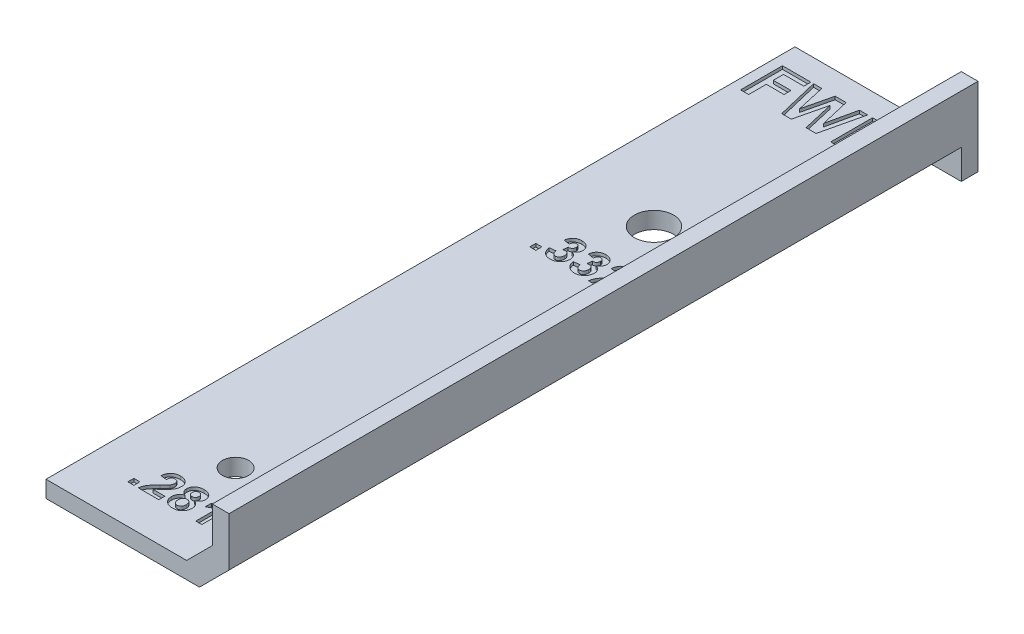
from build123d import *

# Parameters (mm, degrees)
BOSS_EXTRUDE1_DEPTH         = 88.9
F_1_8_0_1250_DOWEL_HOLE2_D  = 3.175
F_3_16_0_1875_DOWEL_HOLE1_D = 4.7625
BOSS_EXTRUDE2_START         = -88.9
BOSS_EXTRUDE2_DEPTH         = 2.032
SKETCH10_W                  = 0.732692308
SKETCH10_H                  = 0.732692308
CUT_EXTRUDE2_DEPTH          = 0.381


with BuildPart() as part:
    # Sketch1 → Boss-Extrude1 (new body)
    with BuildSketch(Plane.XY):
        Polygon((0, 3.592102448), (-3.592102448, 0), (-22.225, 0), (-22.225, 2.032), (-5.152204897, 2.032), (-2.032, 5.152204897), (-2.032, 9.525), (0, 9.525), align=None)
    extrude(amount=BOSS_EXTRUDE1_DEPTH)

    # 1/8 (0.1250) Dowel Hole2 (through all)
    with Locations(Plane(origin=(0, 2.032, 0), x_dir=(1, 0, 0), z_dir=(0, 1, 0))):
        with Locations((-11.90625, -76.2)):
            Hole(F_1_8_0_1250_DOWEL_HOLE2_D / 2)

    # 3/16 (0.1875) Dowel Hole1 (through all)
    with Locations(Plane(origin=(0, 2.032, 0), x_dir=(1, 0, 0), z_dir=(0, 1, 0))):
        with Locations((-11.90625, -25.4)):
            Hole(F_3_16_0_1875_DOWEL_HOLE1_D / 2)

    # Sketch6 → Boss-Extrude2 (add)
    with BuildSketch(Plane.XY.offset(88.9).offset(BOSS_EXTRUDE2_START)):
        Polygon((-22.225, 0), (0, 0), (0, 9.525), (-2.032, 9.525), (-2.032, 5.152204897), (-5.152204897, 2.032), (-22.225, 2.032), align=None)
    extrude(amount=-BOSS_EXTRUDE2_DEPTH)

    # Sketch10 → Cut-Extrude2 (cut)
    # profile 1 of 11: a face of its own
    with BuildSketch(Plane(origin=(0, 2.032, 0), x_dir=(1, 0, 0), z_dir=(0, 1, 0))):
        Polygon((-20.999270946, -5.79415312), (-20.999270946, -0.71415312), (-17.547476074, -0.71415312), (-17.547476074, -1.560819787), (-20.022347869, -1.560819787), (-20.022347869, -2.798255684), (-17.8731171, -2.798255684), (-17.8731171, -3.644922351), (-20.022347869, -3.644922351), (-20.022347869, -5.79415312), align=None)
    # profile 2 of 11: a face of its own
    with BuildSketch(Plane(origin=(0, 2.032, 0), x_dir=(1, 0, 0), z_dir=(0, 1, 0))):
        Polygon((-16.005769343, -5.79415312), (-17.221835049, -0.71415312), (-16.220488895, -0.71415312), (-15.430809407, -4.203600235), (-14.595336651, -0.71415312), (-13.262243702, -0.71415312), (-12.434911972, -4.262622671), (-11.647267741, -0.71415312), (-10.643886331, -0.71415312), (-11.837564215, -5.79415312), (-13.047524151, -5.79415312), (-13.93286069, -1.996364658), (-14.841602677, -5.79415312), align=None)
    # profile 3 of 11: a face of its own
    with BuildSketch(Plane(origin=(0, 2.032, 0), x_dir=(1, 0, 0), z_dir=(0, 1, 0))):
        with BuildLine():
            Line((-10.057732484, -0.71415312), (-8.194455241, -0.71415312))
            add(Edge.make_bspline(
                [(-8.194455241, -0.71415312), (-8.143566114, -0.714126738), (-8.044473164, -0.714075368), (-7.90066335, -0.720041386), (-7.766182685, -0.726042416), (-7.641417162, -0.738055166), (-7.525933931, -0.750646657), (-7.419525761, -0.766588433), (-7.32286484, -0.787019564), (-7.261910517, -0.803131954), (-7.232796587, -0.810827799)],
                knots=[0, 0, 0, 0, 1.259756885, 2.453039283, 3.563158368, 4.591894114, 5.55549294, 6.43918076, 7.254497783, 8, 8, 8, 8], degree=3))
            add(Edge.make_bspline(
                [(-7.232796587, -0.810827799), (-7.196387838, -0.822693979), (-7.124226148, -0.846212599), (-7.018434891, -0.887421139), (-6.918203184, -0.938528038), (-6.819812548, -0.992250897), (-6.727655423, -1.055771929), (-6.636854674, -1.12185706), (-6.553303123, -1.19840977), (-6.443736009, -1.305397224), (-6.318711604, -1.454434132), (-6.187729488, -1.6521241), (-6.076866162, -1.869116038), (-6.001119241, -2.063533259), (-5.949971979, -2.22880432), (-5.916537572, -2.361309804), (-5.888137077, -2.500887431), (-5.864820183, -2.647572389), (-5.846703627, -2.801364699), (-5.833215658, -2.962223367), (-5.826645657, -3.130287355), (-5.825158101, -3.244651031), (-5.824399151, -3.302999274)],
                knots=[0, 0, 0, 0, 0.745524535, 1.477620414, 2.207090574, 2.934465325, 3.657932502, 4.384347339, 5.118673636, 5.861150177, 7.365375624, 8.894729774, 10.468936425, 12.099947606, 12.950091786, 13.83580991, 14.759228729, 15.722225242, 16.726454549, 17.773376212, 18.863978586, 20, 20, 20, 20], degree=3))
            add(Edge.make_bspline(
                [(-5.824399151, -3.302999274), (-5.825784583, -3.403842946), (-5.828463981, -3.598872584), (-5.859504973, -3.880299536), (-5.904238964, -4.141694107), (-5.954663452, -4.304763405), (-5.979078638, -4.383720428)],
                knots=[0, 0, 0, 0, 1.103207939, 2.133582005, 3.096293362, 4, 4, 4, 4], degree=3))
            add(Edge.make_bspline(
                [(-5.979078638, -4.383720428), (-5.995200751, -4.429027688), (-6.026915463, -4.518154138), (-6.082413829, -4.646719479), (-6.142380207, -4.769068417), (-6.207311992, -4.885104555), (-6.277537238, -4.994305959), (-6.353318614, -5.096346002), (-6.433481448, -5.192568072), (-6.491554783, -5.251793212), (-6.520456843, -5.281268505)],
                knots=[0, 0, 0, 0, 1.090884612, 2.145940218, 3.175104604, 4.181306866, 5.161203701, 6.118658341, 7.063689906, 8, 8, 8, 8], degree=3))
            add(Edge.make_bspline(
                [(-6.520456843, -5.281268505), (-6.56722736, -5.323329598), (-6.663674831, -5.410065567), (-6.833631794, -5.517404795), (-7.025730953, -5.612252689), (-7.16468374, -5.660974477), (-7.2368671, -5.68628453)],
                knots=[0, 0, 0, 0, 0.908140292, 1.872714733, 2.8949153, 4, 4, 4, 4], degree=3))
            add(Edge.make_bspline(
                [(-7.2368671, -5.68628453), (-7.265924566, -5.695208943), (-7.326231832, -5.713731101), (-7.42185495, -5.733513148), (-7.523935027, -5.754353731), (-7.633649189, -5.766908419), (-7.749858549, -5.780147894), (-7.873489188, -5.787581119), (-8.004112545, -5.792858277), (-8.093703902, -5.793715106), (-8.139503318, -5.79415312)],
                knots=[0, 0, 0, 0, 0.799129865, 1.658552685, 2.566799617, 3.538529252, 4.561352959, 5.643373779, 6.795284424, 8, 8, 8, 8], degree=3))
            Line((-8.139503318, -5.79415312), (-10.057732484, -5.79415312))
            Line((-10.057732484, -5.79415312), (-10.057732484, -0.71415312))
        make_face()
        with BuildLine():
            Line((-9.080809407, -1.560819787), (-9.080809407, -4.947486453))
            Line((-9.080809407, -4.947486453), (-8.276883125, -4.947486453))
            add(Edge.make_bspline(
                [(-8.276883125, -4.947486453), (-8.240587961, -4.947198608), (-8.170705905, -4.946644395), (-8.069584781, -4.945015909), (-7.976655317, -4.940607288), (-7.891430694, -4.936040676), (-7.814132785, -4.928495833), (-7.744425252, -4.921075193), (-7.682696124, -4.910693872), (-7.644570698, -4.902498995), (-7.626618702, -4.898640299)],
                knots=[0, 0, 0, 0, 1.333384787, 2.567275092, 3.714769766, 4.750907381, 5.701951617, 6.567520054, 7.325492842, 8, 8, 8, 8], degree=3))
            add(Edge.make_bspline(
                [(-7.626618702, -4.898640299), (-7.584573094, -4.887420445), (-7.502679341, -4.865567129), (-7.387692231, -4.816849798), (-7.283643711, -4.758077668), (-7.188791287, -4.687406708), (-7.103309618, -4.59809496), (-7.030340564, -4.483872238), (-6.962809628, -4.347645528), (-6.916564428, -4.217242498), (-6.883369711, -4.100769561), (-6.860899611, -4.003010951), (-6.843142099, -3.89724602), (-6.827868322, -3.783892184), (-6.815526747, -3.663095211), (-6.807847236, -3.534418883), (-6.802605921, -3.398020712), (-6.801758232, -3.304361439), (-6.801322228, -3.256188376)],
                knots=[0, 0, 0, 0, 1.038686998, 2.023088296, 2.974059649, 3.888265163, 4.839857954, 5.909819677, 7.113156087, 8.466843969, 9.20827164, 10.006482943, 10.861893492, 11.769681931, 12.739021491, 13.762258324, 14.849031541, 16, 16, 16, 16], degree=3))
            add(Edge.make_bspline(
                [(-6.801322228, -3.256188376), (-6.801754879, -3.208015166), (-6.802593005, -3.114694581), (-6.80782628, -2.979313459), (-6.815462655, -2.852663425), (-6.827892123, -2.734587919), (-6.842929131, -2.624923753), (-6.860894642, -2.523578126), (-6.883229289, -2.431216137), (-6.91645224, -2.321488388), (-6.966816523, -2.198150991), (-7.035352482, -2.063300551), (-7.119516999, -1.948363722), (-7.212510595, -1.848516221), (-7.319733781, -1.766346773), (-7.43842959, -1.697525075), (-7.571182368, -1.644108376), (-7.665613589, -1.621356452), (-7.714134728, -1.60966594)],
                knots=[0, 0, 0, 0, 1.117996097, 2.165769068, 3.143980016, 4.062055362, 4.920439205, 5.712587309, 6.449616741, 7.124491204, 8.371470382, 9.537068822, 10.625202851, 11.666538334, 12.693249444, 13.747832046, 14.842779399, 16, 16, 16, 16], degree=3))
            add(Edge.make_bspline(
                [(-7.714134728, -1.60966594), (-7.735137041, -1.605763417), (-7.781376095, -1.597171553), (-7.858105355, -1.587136207), (-7.948125873, -1.579689122), (-8.051896558, -1.572086303), (-8.168997232, -1.567746853), (-8.299917873, -1.563217932), (-8.444110639, -1.561670861), (-8.544858914, -1.56111163), (-8.59743601, -1.560819787)],
                knots=[0, 0, 0, 0, 0.578738571, 1.274160813, 2.095454135, 3.025967819, 4.093109015, 5.270126069, 6.575371698, 8, 8, 8, 8], degree=3))
            Line((-8.59743601, -1.560819787), (-9.080809407, -1.560819787))
        make_face(mode=Mode.SUBTRACT)
    # profile 4 of 11: a face of its own
    with BuildSketch(Plane(origin=(0, 2.032, 0), x_dir=(1, 0, 0), z_dir=(0, 1, 0))):
        with Locations((-16.923411588, -34.73131192)):
            Rectangle(SKETCH10_W, SKETCH10_H)
    # profile 5 of 11: a face of its own
    with BuildSketch(Plane(origin=(0, 2.032, 0), x_dir=(1, 0, 0), z_dir=(0, 1, 0))):
        with BuildLine():
            Line((-16.019757742, -34.015410477), (-15.287065434, -33.925350381))
            add(Edge.make_bspline(
                [(-15.287065434, -33.925350381), (-15.280737876, -33.970402077), (-15.268727278, -34.055916542), (-15.231277756, -34.174279412), (-15.182389278, -34.277280595), (-15.117663386, -34.361674898), (-15.042829359, -34.428795372), (-14.959372119, -34.476688273), (-14.868046576, -34.506890447), (-14.804436868, -34.509942602), (-14.771891155, -34.511504227)],
                knots=[0, 0, 0, 0, 1.26631894, 2.403651751, 3.447242243, 4.428907923, 5.348362865, 6.231623936, 7.095215805, 8, 8, 8, 8], degree=3))
            add(Edge.make_bspline(
                [(-14.771891155, -34.511504227), (-14.754309141, -34.511126663), (-14.719481919, -34.510378767), (-14.668285012, -34.502531868), (-14.619092816, -34.489633434), (-14.572390686, -34.471073549), (-14.527955672, -34.448012639), (-14.485202639, -34.420550233), (-14.445927559, -34.386250829), (-14.407582395, -34.348723648), (-14.373554462, -34.306005159), (-14.343579905, -34.259657391), (-14.317268196, -34.210140044), (-14.296873925, -34.156176376), (-14.280909787, -34.098935313), (-14.269496955, -34.038168382), (-14.262551115, -33.974104642), (-14.261720239, -33.930201916), (-14.261296203, -33.907796295)],
                knots=[0, 0, 0, 0, 0.951760839, 1.885289532, 2.797832748, 3.70117291, 4.60103766, 5.506897018, 6.445598779, 7.420035506, 8.410036365, 9.396193293, 10.407074535, 11.440988179, 12.514285005, 13.622404236, 14.786601276, 16, 16, 16, 16], degree=3))
            add(Edge.make_bspline(
                [(-14.261296203, -33.907796295), (-14.262884515, -33.866212797), (-14.265914392, -33.78688774), (-14.289327223, -33.674346961), (-14.329929254, -33.57541905), (-14.386814688, -33.491878725), (-14.454410771, -33.424676806), (-14.530132314, -33.374162454), (-14.614694981, -33.345142338), (-14.673481553, -33.341193088), (-14.703201251, -33.339196535)],
                knots=[0, 0, 0, 0, 1.241512862, 2.368321189, 3.414110003, 4.41529485, 5.36642979, 6.245396713, 7.112955941, 8, 8, 8, 8], degree=3))
            add(Edge.make_bspline(
                [(-14.703201251, -33.339196535), (-14.724359829, -33.339737945), (-14.769213781, -33.340885676), (-14.838981675, -33.352810738), (-14.915063866, -33.369267861), (-14.966870055, -33.385098523), (-14.993988511, -33.393385237)],
                knots=[0, 0, 0, 0, 0.854525515, 1.811503923, 2.854410343, 4, 4, 4, 4], degree=3))
            Line((-14.993988511, -33.393385237), (-14.925298607, -32.801888843))
            add(Edge.make_bspline(
                [(-14.925298607, -32.801888843), (-14.904937575, -32.802238119), (-14.865427091, -32.802915888), (-14.807729932, -32.798132263), (-14.753723612, -32.789398432), (-14.703534145, -32.775227839), (-14.657114799, -32.758036017), (-14.614059601, -32.736435772), (-14.575421869, -32.709555383), (-14.528377927, -32.668979578), (-14.48024772, -32.608179164), (-14.436734968, -32.524808138), (-14.412490535, -32.429747542), (-14.409423055, -32.363167795), (-14.407834665, -32.328691727)],
                knots=[0, 0, 0, 0, 0.916749589, 1.778948191, 2.604102396, 3.376994206, 4.124053722, 4.831292757, 5.54010828, 6.238660037, 7.62386988, 9.002523041, 10.447858069, 12, 12, 12, 12], degree=3))
            add(Edge.make_bspline(
                [(-14.407834665, -32.328691727), (-14.408905558, -32.299334365), (-14.410958919, -32.243043745), (-14.429378954, -32.162944798), (-14.460818124, -32.092227339), (-14.504794343, -32.032118889), (-14.558738411, -31.983308988), (-14.621790553, -31.947242027), (-14.694010566, -31.926210184), (-14.744784112, -31.923871499), (-14.771127934, -31.922658074)],
                knots=[0, 0, 0, 0, 1.146968804, 2.199229744, 3.192297141, 4.153502289, 5.090509175, 6.0173182, 6.971286811, 8, 8, 8, 8], degree=3))
            add(Edge.make_bspline(
                [(-14.771127934, -31.922658074), (-14.797538138, -31.92396361), (-14.849451449, -31.926529842), (-14.92373563, -31.951913943), (-14.99226677, -31.991189231), (-15.052740578, -32.047435095), (-15.105154538, -32.117390511), (-15.145771572, -32.202706482), (-15.17437603, -32.302046367), (-15.184206843, -32.37354545), (-15.189373126, -32.411119612)],
                knots=[0, 0, 0, 0, 0.889956214, 1.749345552, 2.62404616, 3.543272128, 4.520224035, 5.562553653, 6.719074424, 8, 8, 8, 8], degree=3))
            Line((-15.189373126, -32.411119612), (-15.922065434, -32.301215766))
            add(Edge.make_bspline(
                [(-15.922065434, -32.301215766), (-15.909984135, -32.245276311), (-15.886857822, -32.138195664), (-15.839607258, -31.98816761), (-15.784165757, -31.855727457), (-15.719390561, -31.739391036), (-15.64266298, -31.637110006), (-15.55156386, -31.548330173), (-15.447456198, -31.470475356), (-15.330538785, -31.405239846), (-15.203415696, -31.352953156), (-15.068125985, -31.314254419), (-14.925014697, -31.292076572), (-14.82717326, -31.289151214), (-14.777233703, -31.287658074)],
                knots=[0, 0, 0, 0, 1.220808349, 2.336900656, 3.3513467, 4.279992853, 5.171472476, 6.069835959, 6.985198729, 7.938095762, 8.919113729, 9.91246339, 10.934493858, 12, 12, 12, 12], degree=3))
            add(Edge.make_bspline(
                [(-14.777233703, -31.287658074), (-14.734440575, -31.288631834), (-14.650830505, -31.290534387), (-14.528907207, -31.306905476), (-14.413547014, -31.333500492), (-14.304589112, -31.371120987), (-14.201528408, -31.419020571), (-14.106085408, -31.479286262), (-14.01625788, -31.548849024), (-13.963052, -31.602985885), (-13.936163992, -31.630344372)],
                knots=[0, 0, 0, 0, 1.096978699, 2.143298912, 3.148181587, 4.128190255, 5.094201205, 6.055441919, 7.017302331, 8, 8, 8, 8], degree=3))
            add(Edge.make_bspline(
                [(-13.936163992, -31.630344372), (-13.915394708, -31.653657882), (-13.874373219, -31.699704483), (-13.82111234, -31.773529266), (-13.77653585, -31.850239877), (-13.738723459, -31.92823572), (-13.710603825, -32.009325433), (-13.689640412, -32.092236113), (-13.677188886, -32.177702401), (-13.675826477, -32.235539063), (-13.675142357, -32.26458115)],
                knots=[0, 0, 0, 0, 1.065582675, 2.104636323, 3.101288825, 4.092056841, 5.059084899, 6.026073946, 7.008813224, 8, 8, 8, 8], degree=3))
            add(Edge.make_bspline(
                [(-13.675142357, -32.26458115), (-13.676634658, -32.305430801), (-13.679576258, -32.385952973), (-13.706569022, -32.503088829), (-13.749953727, -32.613819009), (-13.809942354, -32.718566503), (-13.888153588, -32.816359294), (-13.98443448, -32.906317456), (-14.09595589, -32.991873837), (-14.179776064, -33.040201086), (-14.223135145, -33.065200141)],
                knots=[0, 0, 0, 0, 0.957571776, 1.887550067, 2.804499428, 3.740591036, 4.709432777, 5.731457079, 6.826512349, 8, 8, 8, 8], degree=3))
            add(Edge.make_bspline(
                [(-14.223135145, -33.065200141), (-14.197334288, -33.071418731), (-14.146420143, -33.083690191), (-14.072868527, -33.108707809), (-14.003987118, -33.140798662), (-13.938088883, -33.176058945), (-13.876809162, -33.217870473), (-13.818960136, -33.264200393), (-13.766754184, -33.317724493), (-13.716729189, -33.374272865), (-13.673000951, -33.436332409), (-13.633489664, -33.500912012), (-13.601753398, -33.569587345), (-13.574609318, -33.640592644), (-13.554383659, -33.715075592), (-13.538545579, -33.792478938), (-13.530607009, -33.873284463), (-13.529276749, -33.928135321), (-13.528603895, -33.955879227)],
                knots=[0, 0, 0, 0, 1.037381978, 2.047118658, 3.030848314, 4.005687143, 4.965748246, 5.927353932, 6.897971669, 7.885165084, 8.876109723, 9.862099733, 10.840989857, 11.829385213, 12.830906716, 13.855042526, 14.915067134, 16, 16, 16, 16], degree=3))
            add(Edge.make_bspline(
                [(-13.528603895, -33.955879227), (-13.529458892, -33.99640065), (-13.531145061, -34.076314344), (-13.549665566, -34.193598992), (-13.577803882, -34.306317244), (-13.616580979, -34.414924475), (-13.66844017, -34.518091871), (-13.730452678, -34.617266777), (-13.804307597, -34.711461304), (-13.88852591, -34.799961629), (-13.980549222, -34.880964406), (-14.079427969, -34.952114301), (-14.183697174, -35.012333719), (-14.293954274, -35.061574305), (-14.409240512, -35.099886833), (-14.530548337, -35.126218791), (-14.656893744, -35.143786271), (-14.743336946, -35.145589937), (-14.787155578, -35.146504227)],
                knots=[0, 0, 0, 0, 1.006520189, 1.984993146, 2.943645202, 3.891894145, 4.845023195, 5.808336607, 6.795092628, 7.815033679, 8.841288157, 9.838185905, 10.83832808, 11.829129029, 12.835072876, 13.85234392, 14.911338897, 16, 16, 16, 16], degree=3))
            add(Edge.make_bspline(
                [(-14.787155578, -35.146504227), (-14.828680037, -35.145808066), (-14.910243852, -35.144440643), (-15.029646482, -35.128241289), (-15.144007543, -35.104410133), (-15.252659528, -35.069547717), (-15.356548882, -35.02660699), (-15.453714733, -34.971252128), (-15.546658275, -34.908336737), (-15.632342954, -34.834636381), (-15.712011172, -34.754310533), (-15.78199016, -34.665974536), (-15.844350767, -34.572447769), (-15.897986857, -34.47290105), (-15.942448958, -34.3670757), (-15.977068854, -34.255244879), (-16.004678888, -34.137751041), (-16.014662194, -34.056752621), (-16.019757742, -34.015410477)],
                knots=[0, 0, 0, 0, 1.077528213, 2.11651914, 3.123276654, 4.10732375, 5.075386463, 6.036572488, 7.005896639, 7.98540975, 8.966414275, 9.939311093, 10.906719916, 11.882103104, 12.870994428, 13.882228509, 14.919075059, 16, 16, 16, 16], degree=3))
        make_face()
    # profile 6 of 11: a face of its own
    with BuildSketch(Plane(origin=(0, 2.032, 0), x_dir=(1, 0, 0), z_dir=(0, 1, 0))):
        with BuildLine():
            Line((-13.088988511, -34.015410477), (-12.356296203, -33.925350381))
            add(Edge.make_bspline(
                [(-12.356296203, -33.925350381), (-12.349968645, -33.970402077), (-12.337958047, -34.055916542), (-12.300508526, -34.174279412), (-12.251620047, -34.277280595), (-12.186894155, -34.361674898), (-12.112060128, -34.428795372), (-12.028602888, -34.476688273), (-11.937277346, -34.506890447), (-11.873667637, -34.509942602), (-11.841121924, -34.511504227)],
                knots=[0, 0, 0, 0, 1.26631894, 2.403651751, 3.447242243, 4.428907923, 5.348362865, 6.231623936, 7.095215805, 8, 8, 8, 8], degree=3))
            add(Edge.make_bspline(
                [(-11.841121924, -34.511504227), (-11.823539911, -34.511126663), (-11.788712688, -34.510378767), (-11.737515781, -34.502531868), (-11.688323586, -34.489633434), (-11.641621455, -34.471073549), (-11.597186441, -34.448012639), (-11.554433408, -34.420550233), (-11.515158328, -34.386250829), (-11.476813165, -34.348723648), (-11.442785232, -34.306005159), (-11.412810675, -34.259657391), (-11.386498965, -34.210140044), (-11.366104694, -34.156176376), (-11.350140556, -34.098935313), (-11.338727724, -34.038168382), (-11.331781885, -33.974104642), (-11.330951008, -33.930201916), (-11.330526972, -33.907796295)],
                knots=[0, 0, 0, 0, 0.951760839, 1.885289532, 2.797832748, 3.70117291, 4.60103766, 5.506897018, 6.445598779, 7.420035506, 8.410036365, 9.396193293, 10.407074535, 11.440988179, 12.514285005, 13.622404236, 14.786601276, 16, 16, 16, 16], degree=3))
            add(Edge.make_bspline(
                [(-11.330526972, -33.907796295), (-11.332115284, -33.866212797), (-11.335145162, -33.78688774), (-11.358557992, -33.674346961), (-11.399160023, -33.57541905), (-11.456045457, -33.491878725), (-11.523641541, -33.424676806), (-11.599363083, -33.374162454), (-11.68392575, -33.345142338), (-11.742712322, -33.341193088), (-11.77243202, -33.339196535)],
                knots=[0, 0, 0, 0, 1.241512862, 2.368321189, 3.414110003, 4.41529485, 5.36642979, 6.245396713, 7.112955941, 8, 8, 8, 8], degree=3))
            add(Edge.make_bspline(
                [(-11.77243202, -33.339196535), (-11.793590598, -33.339737945), (-11.83844455, -33.340885676), (-11.908212444, -33.352810738), (-11.984294635, -33.369267861), (-12.036100824, -33.385098523), (-12.06321928, -33.393385237)],
                knots=[0, 0, 0, 0, 0.854525515, 1.811503923, 2.854410343, 4, 4, 4, 4], degree=3))
            Line((-12.06321928, -33.393385237), (-11.994529376, -32.801888843))
            add(Edge.make_bspline(
                [(-11.994529376, -32.801888843), (-11.974168345, -32.802238119), (-11.93465786, -32.802915888), (-11.876960701, -32.798132263), (-11.822954381, -32.789398432), (-11.772764914, -32.775227839), (-11.726345569, -32.758036017), (-11.68329037, -32.736435772), (-11.644652638, -32.709555383), (-11.597608696, -32.668979578), (-11.549478489, -32.608179164), (-11.505965738, -32.524808138), (-11.481721304, -32.429747542), (-11.478653824, -32.363167795), (-11.477065434, -32.328691727)],
                knots=[0, 0, 0, 0, 0.916749589, 1.778948191, 2.604102396, 3.376994206, 4.124053722, 4.831292757, 5.54010828, 6.238660037, 7.62386988, 9.002523041, 10.447858069, 12, 12, 12, 12], degree=3))
            add(Edge.make_bspline(
                [(-11.477065434, -32.328691727), (-11.478136327, -32.299334365), (-11.480189688, -32.243043745), (-11.498609723, -32.162944798), (-11.530048893, -32.092227339), (-11.574025113, -32.032118889), (-11.62796918, -31.983308988), (-11.691021322, -31.947242027), (-11.763241336, -31.926210184), (-11.814014881, -31.923871499), (-11.840358703, -31.922658074)],
                knots=[0, 0, 0, 0, 1.146968804, 2.199229744, 3.192297141, 4.153502289, 5.090509175, 6.0173182, 6.971286811, 8, 8, 8, 8], degree=3))
            add(Edge.make_bspline(
                [(-11.840358703, -31.922658074), (-11.866768908, -31.92396361), (-11.918682219, -31.926529842), (-11.992966399, -31.951913943), (-12.06149754, -31.991189231), (-12.121971347, -32.047435095), (-12.174385307, -32.117390511), (-12.215002342, -32.202706482), (-12.243606799, -32.302046367), (-12.253437612, -32.37354545), (-12.258603895, -32.411119612)],
                knots=[0, 0, 0, 0, 0.889956214, 1.749345552, 2.62404616, 3.543272128, 4.520224035, 5.562553653, 6.719074424, 8, 8, 8, 8], degree=3))
            Line((-12.258603895, -32.411119612), (-12.991296203, -32.301215766))
            add(Edge.make_bspline(
                [(-12.991296203, -32.301215766), (-12.979214904, -32.245276311), (-12.956088591, -32.138195664), (-12.908838027, -31.98816761), (-12.853396526, -31.855727457), (-12.78862133, -31.739391036), (-12.71189375, -31.637110006), (-12.62079463, -31.548330173), (-12.516686968, -31.470475356), (-12.399769554, -31.405239846), (-12.272646466, -31.352953156), (-12.137356754, -31.314254419), (-11.994245466, -31.292076572), (-11.896404029, -31.289151214), (-11.846464472, -31.287658074)],
                knots=[0, 0, 0, 0, 1.220808349, 2.336900656, 3.3513467, 4.279992853, 5.171472476, 6.069835959, 6.985198729, 7.938095762, 8.919113729, 9.91246339, 10.934493858, 12, 12, 12, 12], degree=3))
            add(Edge.make_bspline(
                [(-11.846464472, -31.287658074), (-11.803671344, -31.288631834), (-11.720061274, -31.290534387), (-11.598137977, -31.306905476), (-11.482777783, -31.333500492), (-11.373819881, -31.371120987), (-11.270759178, -31.419020571), (-11.175316177, -31.479286262), (-11.085488649, -31.548849024), (-11.032282769, -31.602985885), (-11.005394761, -31.630344372)],
                knots=[0, 0, 0, 0, 1.096978699, 2.143298912, 3.148181587, 4.128190255, 5.094201205, 6.055441919, 7.017302331, 8, 8, 8, 8], degree=3))
            add(Edge.make_bspline(
                [(-11.005394761, -31.630344372), (-10.984625477, -31.653657882), (-10.943603988, -31.699704483), (-10.890343109, -31.773529266), (-10.845766619, -31.850239877), (-10.807954229, -31.92823572), (-10.779834594, -32.009325433), (-10.758871181, -32.092236113), (-10.746419655, -32.177702401), (-10.745057246, -32.235539063), (-10.744373126, -32.26458115)],
                knots=[0, 0, 0, 0, 1.065582675, 2.104636323, 3.101288825, 4.092056841, 5.059084899, 6.026073946, 7.008813224, 8, 8, 8, 8], degree=3))
            add(Edge.make_bspline(
                [(-10.744373126, -32.26458115), (-10.745865427, -32.305430801), (-10.748807027, -32.385952973), (-10.775799791, -32.503088829), (-10.819184497, -32.613819009), (-10.879173123, -32.718566503), (-10.957384357, -32.816359294), (-11.053665249, -32.906317456), (-11.16518666, -32.991873837), (-11.249006833, -33.040201086), (-11.292365915, -33.065200141)],
                knots=[0, 0, 0, 0, 0.957571776, 1.887550067, 2.804499428, 3.740591036, 4.709432777, 5.731457079, 6.826512349, 8, 8, 8, 8], degree=3))
            add(Edge.make_bspline(
                [(-11.292365915, -33.065200141), (-11.266565057, -33.071418731), (-11.215650912, -33.083690191), (-11.142099297, -33.108707809), (-11.073217887, -33.140798662), (-11.007319652, -33.176058945), (-10.946039931, -33.217870473), (-10.888190906, -33.264200393), (-10.835984953, -33.317724493), (-10.785959958, -33.374272865), (-10.74223172, -33.436332409), (-10.702720434, -33.500912012), (-10.670984167, -33.569587345), (-10.643840087, -33.640592644), (-10.623614428, -33.715075592), (-10.607776349, -33.792478938), (-10.599837778, -33.873284463), (-10.598507518, -33.928135321), (-10.597834665, -33.955879227)],
                knots=[0, 0, 0, 0, 1.037381978, 2.047118658, 3.030848314, 4.005687143, 4.965748246, 5.927353932, 6.897971669, 7.885165084, 8.876109723, 9.862099733, 10.840989857, 11.829385213, 12.830906716, 13.855042526, 14.915067134, 16, 16, 16, 16], degree=3))
            add(Edge.make_bspline(
                [(-10.597834665, -33.955879227), (-10.598689662, -33.99640065), (-10.60037583, -34.076314344), (-10.618896335, -34.193598992), (-10.647034652, -34.306317244), (-10.685811748, -34.414924475), (-10.737670939, -34.518091871), (-10.799683448, -34.617266777), (-10.873538366, -34.711461304), (-10.957756679, -34.799961629), (-11.049779991, -34.880964406), (-11.148658738, -34.952114301), (-11.252927943, -35.012333719), (-11.363185044, -35.061574305), (-11.478471282, -35.099886833), (-11.599779106, -35.126218791), (-11.726124514, -35.143786271), (-11.812567715, -35.145589937), (-11.856386347, -35.146504227)],
                knots=[0, 0, 0, 0, 1.006520189, 1.984993146, 2.943645202, 3.891894145, 4.845023195, 5.808336607, 6.795092628, 7.815033679, 8.841288157, 9.838185905, 10.83832808, 11.829129029, 12.835072876, 13.85234392, 14.911338897, 16, 16, 16, 16], degree=3))
            add(Edge.make_bspline(
                [(-11.856386347, -35.146504227), (-11.897910806, -35.145808066), (-11.979474621, -35.144440643), (-12.098877251, -35.128241289), (-12.213238312, -35.104410133), (-12.321890297, -35.069547717), (-12.425779652, -35.02660699), (-12.522945502, -34.971252128), (-12.615889044, -34.908336737), (-12.701573723, -34.834636381), (-12.781241941, -34.754310533), (-12.85122093, -34.665974536), (-12.913581536, -34.572447769), (-12.967217626, -34.47290105), (-13.011679727, -34.3670757), (-13.046299623, -34.255244879), (-13.073909657, -34.137751041), (-13.083892964, -34.056752621), (-13.088988511, -34.015410477)],
                knots=[0, 0, 0, 0, 1.077528213, 2.11651914, 3.123276654, 4.10732375, 5.075386463, 6.036572488, 7.005896639, 7.98540975, 8.966414275, 9.939311093, 10.906719916, 11.882103104, 12.870994428, 13.882228509, 14.919075059, 16, 16, 16, 16], degree=3))
        make_face()
    # profile 7 of 11: a face of its own
    with BuildSketch(Plane(origin=(0, 2.032, 0), x_dir=(1, 0, 0), z_dir=(0, 1, 0))):
        with BuildLine():
            Line((-7.667065434, -34.364965766), (-7.667065434, -35.097658074))
            Line((-7.667065434, -35.097658074), (-10.15821928, -35.097658074))
            add(Edge.make_bspline(
                [(-10.15821928, -35.097658074), (-10.14978481, -35.035038885), (-10.1329206, -34.90983562), (-10.080782492, -34.726945163), (-10.011195976, -34.548475324), (-9.93567303, -34.403244196), (-9.860557096, -34.286338135), (-9.792404404, -34.190544405), (-9.711100745, -34.088623989), (-9.617825924, -33.979754105), (-9.513095414, -33.863594429), (-9.396127859, -33.740576817), (-9.266365305, -33.611290189), (-9.175075037, -33.523498208), (-9.127870722, -33.478102785)],
                knots=[0, 0, 0, 0, 1.156289446, 2.311930546, 3.473459201, 4.661751613, 5.303057008, 6.018253237, 6.81459331, 7.690699809, 8.644447906, 9.679642995, 10.800191253, 12, 12, 12, 12], degree=3))
            add(Edge.make_bspline(
                [(-9.127870722, -33.478102785), (-9.090201139, -33.441741325), (-9.018489348, -33.372519813), (-8.916371618, -33.273397414), (-8.826599611, -33.182275755), (-8.747296318, -33.101516188), (-8.680293758, -33.02906237), (-8.624710572, -32.966052178), (-8.579842809, -32.912229015), (-8.555542389, -32.878083566), (-8.544769761, -32.862946535)],
                knots=[0, 0, 0, 0, 1.480720495, 2.818855715, 4.024636094, 5.098235712, 6.019786162, 6.815086302, 7.474715479, 8, 8, 8, 8], degree=3))
            add(Edge.make_bspline(
                [(-8.544769761, -32.862946535), (-8.522710048, -32.826302996), (-8.480159418, -32.755621854), (-8.433499122, -32.64447448), (-8.405491874, -32.533350065), (-8.401648521, -32.459097367), (-8.399757742, -32.422567929)],
                knots=[0, 0, 0, 0, 1.0911822, 2.104764037, 3.067617678, 4, 4, 4, 4], degree=3))
            add(Edge.make_bspline(
                [(-8.399757742, -32.422567929), (-8.401129976, -32.384554139), (-8.403726138, -32.312635011), (-8.425495399, -32.211143824), (-8.464099652, -32.123897771), (-8.517250604, -32.050629048), (-8.58446009, -31.993223285), (-8.663029933, -31.950805998), (-8.75411027, -31.927354767), (-8.818126903, -31.924270198), (-8.851584665, -31.922658074)],
                knots=[0, 0, 0, 0, 1.193122327, 2.257294386, 3.237245624, 4.168877528, 5.075331632, 5.990371598, 6.949684428, 8, 8, 8, 8], degree=3))
            add(Edge.make_bspline(
                [(-8.851584665, -31.922658074), (-8.884816388, -31.924163677), (-8.949012903, -31.927072178), (-9.04025008, -31.952480444), (-9.120065771, -31.996464826), (-9.176946677, -32.046589272), (-9.215372427, -32.095331654), (-9.241554393, -32.13780743), (-9.264121203, -32.186072937), (-9.28411728, -32.239584787), (-9.29991192, -32.298956013), (-9.312631943, -32.363734445), (-9.32288244, -32.434268682), (-9.326142279, -32.483337332), (-9.327834665, -32.50881192)],
                knots=[0, 0, 0, 0, 1.402788338, 2.709884207, 3.961032948, 5.225417836, 5.883680772, 6.578928686, 7.329201998, 8.132101139, 8.990263233, 9.922304639, 10.921339128, 12, 12, 12, 12], degree=3))
            Line((-9.327834665, -32.50881192), (-10.060526972, -32.437069131))
            add(Edge.make_bspline(
                [(-10.060526972, -32.437069131), (-10.05463624, -32.387603165), (-10.04321505, -32.291696561), (-10.01471328, -32.153941609), (-9.978616845, -32.026856448), (-9.933204906, -31.910676924), (-9.880354393, -31.804664249), (-9.81736949, -31.710409209), (-9.746450957, -31.626867725), (-9.667537504, -31.554084258), (-9.581130809, -31.491827267), (-9.490462488, -31.436253349), (-9.393760626, -31.39066507), (-9.292089916, -31.353093478), (-9.185496304, -31.323066563), (-9.07348678, -31.303213173), (-8.956752624, -31.289248223), (-8.877069403, -31.288196112), (-8.836320242, -31.287658074)],
                knots=[0, 0, 0, 0, 1.270971563, 2.464210789, 3.586263665, 4.638946707, 5.643716971, 6.603612468, 7.52484387, 8.434700188, 9.336036235, 10.239171475, 11.145359471, 12.059630629, 13.003312604, 13.96741569, 14.960557767, 16, 16, 16, 16], degree=3))
            add(Edge.make_bspline(
                [(-8.836320242, -31.287658074), (-8.792020639, -31.288509489), (-8.7057416, -31.290167727), (-8.57978952, -31.303861472), (-8.461466591, -31.327738501), (-8.34973835, -31.359367005), (-8.245752187, -31.40159337), (-8.148641588, -31.45264329), (-8.059934905, -31.514454212), (-7.978309844, -31.583655324), (-7.90534357, -31.659754109), (-7.841431717, -31.740926329), (-7.787886577, -31.827115432), (-7.742953981, -31.917270867), (-7.709591832, -32.012843367), (-7.68528272, -32.112511424), (-7.669164799, -32.216740013), (-7.667772962, -32.287925775), (-7.667065434, -32.3241124)],
                knots=[0, 0, 0, 0, 1.210756838, 2.35810096, 3.457354827, 4.507168606, 5.527358126, 6.519769748, 7.499700793, 8.476517721, 9.440526811, 10.376769937, 11.295256217, 12.209626307, 13.124630862, 14.055668209, 15.011616881, 16, 16, 16, 16], degree=3))
            add(Edge.make_bspline(
                [(-7.667065434, -32.3241124), (-7.667997592, -32.365643149), (-7.669846852, -32.448033781), (-7.68755214, -32.569831749), (-7.714602373, -32.688821072), (-7.754580487, -32.805292547), (-7.80525585, -32.922040057), (-7.870577609, -33.03932565), (-7.946421111, -33.160686452), (-8.005803583, -33.239151507), (-8.036464472, -33.279665285)],
                knots=[0, 0, 0, 0, 0.953409949, 1.89141903, 2.821310783, 3.752688675, 4.715703262, 5.740811754, 6.833515735, 8, 8, 8, 8], degree=3))
            add(Edge.make_bspline(
                [(-8.036464472, -33.279665285), (-8.048052942, -33.294260997), (-8.072872759, -33.32552163), (-8.115097789, -33.373454975), (-8.164032967, -33.425813299), (-8.218987105, -33.483576627), (-8.281775446, -33.544699404), (-8.350138863, -33.611737735), (-8.427085543, -33.681262387), (-8.506783658, -33.755007663), (-8.586828196, -33.826782903), (-8.660400666, -33.894953469), (-8.72722895, -33.955269778), (-8.784200728, -34.011061568), (-8.834667068, -34.058521089), (-8.876808994, -34.100082009), (-8.911415083, -34.134738174), (-8.959100045, -34.188758343), (-9.019773749, -34.261820643), (-9.06246018, -34.331633737), (-9.082840674, -34.364965766)],
                knots=[0, 0, 0, 0, 0.665555651, 1.425465941, 2.280616993, 3.225313414, 4.272635571, 5.410053715, 6.644756443, 7.976022804, 9.288331007, 10.484517221, 11.558462543, 12.503158964, 13.33222979, 14.032602617, 14.617328242, 15.080653724, 16.606167857, 18, 18, 18, 18], degree=3))
            Line((-9.082840674, -34.364965766), (-7.667065434, -34.364965766))
        make_face()
    # profile 8 of 11: a face of its own
    with BuildSketch(Plane(origin=(0, 2.032, 0), x_dir=(1, 0, 0), z_dir=(0, 1, 0))):
        with Locations((-16.620271881, -83.839944359)):
            Rectangle(SKETCH10_W, SKETCH10_H)
    # profile 9 of 11: a face of its own
    with BuildSketch(Plane(origin=(0, 2.032, 0), x_dir=(1, 0, 0), z_dir=(0, 1, 0))):
        with BuildLine():
            Line((-13.225464189, -83.473598205), (-13.225464189, -84.206290513))
            Line((-13.225464189, -84.206290513), (-15.716618035, -84.206290513))
            add(Edge.make_bspline(
                [(-15.716618035, -84.206290513), (-15.708183565, -84.143671325), (-15.691319355, -84.018468059), (-15.639181247, -83.835577602), (-15.569594731, -83.657107764), (-15.494071785, -83.511876635), (-15.418955851, -83.394970575), (-15.350803159, -83.299176845), (-15.269499501, -83.197256428), (-15.176224679, -83.088386544), (-15.071494169, -82.972226868), (-14.954526614, -82.849209256), (-14.82476406, -82.719922629), (-14.733473792, -82.632130647), (-14.686269477, -82.586735225)],
                knots=[0, 0, 0, 0, 1.156289446, 2.311930546, 3.473459201, 4.661751613, 5.303057008, 6.018253237, 6.81459331, 7.690699809, 8.644447906, 9.679642995, 10.800191253, 12, 12, 12, 12], degree=3))
            add(Edge.make_bspline(
                [(-14.686269477, -82.586735225), (-14.648599895, -82.550373764), (-14.576888103, -82.481152252), (-14.474770373, -82.382029854), (-14.384998366, -82.290908194), (-14.305695073, -82.210148627), (-14.238692513, -82.13769481), (-14.183109328, -82.074684618), (-14.138241564, -82.020861454), (-14.113941144, -81.986716006), (-14.103168516, -81.971578975)],
                knots=[0, 0, 0, 0, 1.480720495, 2.818855715, 4.024636094, 5.098235712, 6.019786162, 6.815086302, 7.474715479, 8, 8, 8, 8], degree=3))
            add(Edge.make_bspline(
                [(-14.103168516, -81.971578975), (-14.081108803, -81.934935435), (-14.038558173, -81.864254293), (-13.991897877, -81.753106919), (-13.963890629, -81.641982504), (-13.960047276, -81.567729806), (-13.958156497, -81.531200369)],
                knots=[0, 0, 0, 0, 1.0911822, 2.104764037, 3.067617678, 4, 4, 4, 4], degree=3))
            add(Edge.make_bspline(
                [(-13.958156497, -81.531200369), (-13.959528732, -81.493186578), (-13.962124893, -81.421267451), (-13.983894155, -81.319776263), (-14.022498407, -81.23253021), (-14.07564936, -81.159261488), (-14.142858845, -81.101855724), (-14.221428688, -81.059438438), (-14.312509025, -81.035987206), (-14.376525659, -81.032902637), (-14.40998342, -81.031290513)],
                knots=[0, 0, 0, 0, 1.193122327, 2.257294386, 3.237245624, 4.168877528, 5.075331632, 5.990371598, 6.949684428, 8, 8, 8, 8], degree=3))
            add(Edge.make_bspline(
                [(-14.40998342, -81.031290513), (-14.443215143, -81.032796117), (-14.507411658, -81.035704618), (-14.598648835, -81.061112884), (-14.678464526, -81.105097265), (-14.735345432, -81.155221711), (-14.773771182, -81.203964094), (-14.799953148, -81.24643987), (-14.822519959, -81.294705377), (-14.842516035, -81.348217226), (-14.858310676, -81.407588453), (-14.871030698, -81.472366885), (-14.881281195, -81.542901122), (-14.884541035, -81.591969772), (-14.88623342, -81.617444359)],
                knots=[0, 0, 0, 0, 1.402788338, 2.709884207, 3.961032948, 5.225417836, 5.883680772, 6.578928686, 7.329201998, 8.132101139, 8.990263233, 9.922304639, 10.921339128, 12, 12, 12, 12], degree=3))
            Line((-14.88623342, -81.617444359), (-15.618925727, -81.545701571))
            add(Edge.make_bspline(
                [(-15.618925727, -81.545701571), (-15.613034995, -81.496235605), (-15.601613805, -81.400329001), (-15.573112036, -81.262574049), (-15.5370156, -81.135488887), (-15.491603661, -81.019309364), (-15.438753148, -80.913296689), (-15.375768245, -80.819041649), (-15.304849712, -80.735500164), (-15.225936259, -80.662716698), (-15.139529564, -80.600459706), (-15.048861243, -80.544885788), (-14.952159382, -80.499297509), (-14.850488671, -80.461725918), (-14.743895059, -80.431699002), (-14.631885535, -80.411845613), (-14.51515138, -80.397880663), (-14.435468158, -80.396828552), (-14.394718997, -80.396290513)],
                knots=[0, 0, 0, 0, 1.270971563, 2.464210789, 3.586263665, 4.638946707, 5.643716971, 6.603612468, 7.52484387, 8.434700188, 9.336036235, 10.239171475, 11.145359471, 12.059630629, 13.003312604, 13.96741569, 14.960557767, 16, 16, 16, 16], degree=3))
            add(Edge.make_bspline(
                [(-14.394718997, -80.396290513), (-14.350419394, -80.397141928), (-14.264140355, -80.398800167), (-14.138188275, -80.412493912), (-14.019865346, -80.43637094), (-13.908137105, -80.467999444), (-13.804150942, -80.51022581), (-13.707040344, -80.561275729), (-13.61833366, -80.623086651), (-13.536708599, -80.692287763), (-13.463742326, -80.768386549), (-13.399830472, -80.849558769), (-13.346285332, -80.935747871), (-13.301352736, -81.025903307), (-13.267990587, -81.121475806), (-13.243681475, -81.221143864), (-13.227563555, -81.325372453), (-13.226171717, -81.396558215), (-13.225464189, -81.43274484)],
                knots=[0, 0, 0, 0, 1.210756838, 2.35810096, 3.457354827, 4.507168606, 5.527358126, 6.519769748, 7.499700793, 8.476517721, 9.440526811, 10.376769937, 11.295256217, 12.209626307, 13.124630862, 14.055668209, 15.011616881, 16, 16, 16, 16], degree=3))
            add(Edge.make_bspline(
                [(-13.225464189, -81.43274484), (-13.226396348, -81.474275589), (-13.228245607, -81.55666622), (-13.245950895, -81.678464189), (-13.273001128, -81.797453511), (-13.312979242, -81.913924987), (-13.363654606, -82.030672496), (-13.428976364, -82.147958089), (-13.504819866, -82.269318892), (-13.564202338, -82.347783946), (-13.594863227, -82.388297725)],
                knots=[0, 0, 0, 0, 0.953409949, 1.89141903, 2.821310783, 3.752688675, 4.715703262, 5.740811754, 6.833515735, 8, 8, 8, 8], degree=3))
            add(Edge.make_bspline(
                [(-13.594863227, -82.388297725), (-13.606451697, -82.402893437), (-13.631271514, -82.434154069), (-13.673496544, -82.482087414), (-13.722431722, -82.534445738), (-13.77738586, -82.592209067), (-13.840174201, -82.653331843), (-13.908537618, -82.720370174), (-13.985484298, -82.789894827), (-14.065182413, -82.863640103), (-14.145226951, -82.935415343), (-14.218799421, -83.003585909), (-14.285627705, -83.063902218), (-14.342599483, -83.119694008), (-14.393065823, -83.167153528), (-14.435207749, -83.208714449), (-14.469813838, -83.243370614), (-14.517498801, -83.297390782), (-14.578172504, -83.370453082), (-14.620858935, -83.440266176), (-14.641239429, -83.473598205)],
                knots=[0, 0, 0, 0, 0.665555651, 1.425465941, 2.280616993, 3.225313414, 4.272635571, 5.410053715, 6.644756443, 7.976022804, 9.288331007, 10.484517221, 11.558462543, 12.503158964, 13.33222979, 14.032602617, 14.617328242, 15.080653724, 16.606167857, 18, 18, 18, 18], degree=3))
            Line((-14.641239429, -83.473598205), (-13.225464189, -83.473598205))
        make_face()
    # profile 10 of 11: a face of its own
    with BuildSketch(Plane(origin=(0, 2.032, 0), x_dir=(1, 0, 0), z_dir=(0, 1, 0))):
        with BuildLine():
            add(Edge.make_bspline(
                [(-12.137874045, -82.134908302), (-12.161169921, -82.125044109), (-12.206896871, -82.10568191), (-12.271820396, -82.071830216), (-12.332008392, -82.035727081), (-12.386515301, -81.99593414), (-12.437599659, -81.955328763), (-12.482236259, -81.909771487), (-12.523062877, -81.862715228), (-12.569634586, -81.796347493), (-12.617143155, -81.70874132), (-12.657972182, -81.597409211), (-12.683350547, -81.480948707), (-12.686540813, -81.401326194), (-12.688156497, -81.361002052)],
                knots=[0, 0, 0, 0, 0.898135024, 1.762928937, 2.598141881, 3.387992021, 4.158483993, 4.912374357, 5.649344587, 6.368826796, 7.78793972, 9.174346042, 10.568971657, 12, 12, 12, 12], degree=3))
            add(Edge.make_bspline(
                [(-12.688156497, -81.361002052), (-12.687291818, -81.326868536), (-12.685593887, -81.259842017), (-12.671770877, -81.161517882), (-12.647778408, -81.067761432), (-12.615195958, -80.978307504), (-12.572802333, -80.893633947), (-12.521033346, -80.813823047), (-12.460847025, -80.737758806), (-12.39022778, -80.667910471), (-12.311848494, -80.603377026), (-12.224619018, -80.547765922), (-12.129473372, -80.501045463), (-12.026954214, -80.46172937), (-11.916026197, -80.432672052), (-11.797691783, -80.410961046), (-11.671529113, -80.399196416), (-11.584815333, -80.39727666), (-11.540271881, -80.396290513)],
                knots=[0, 0, 0, 0, 0.969401132, 1.903571386, 2.813295953, 3.714164367, 4.602979607, 5.497068024, 6.412430398, 7.352730811, 8.313282239, 9.291613189, 10.283859467, 11.320059661, 12.405231593, 13.536450991, 14.734515125, 16, 16, 16, 16], degree=3))
            add(Edge.make_bspline(
                [(-11.540271881, -80.396290513), (-11.4959801, -80.397257408), (-11.410021943, -80.399133886), (-11.284656593, -80.411130941), (-11.167253938, -80.43242646), (-11.056952477, -80.461979293), (-10.954756766, -80.501266236), (-10.859203784, -80.547287607), (-10.772353425, -80.60387503), (-10.693355181, -80.667837473), (-10.62201036, -80.737748697), (-10.561108444, -80.813824928), (-10.508407674, -80.893413648), (-10.466170746, -80.978335943), (-10.433448888, -81.067744516), (-10.409790934, -81.161592855), (-10.394685567, -81.259766828), (-10.393162482, -81.326855453), (-10.392387266, -81.361002052)],
                knots=[0, 0, 0, 0, 1.259437241, 2.444221022, 3.576496957, 4.648717845, 5.68588583, 6.685544666, 7.658705287, 8.625770615, 9.572078176, 10.492824823, 11.391686538, 12.281331915, 13.183041723, 14.093615956, 15.029693465, 16, 16, 16, 16], degree=3))
            add(Edge.make_bspline(
                [(-10.392387266, -81.361002052), (-10.394058796, -81.40339657), (-10.397348037, -81.486820629), (-10.426035976, -81.607784084), (-10.471185867, -81.722037398), (-10.536025881, -81.827122843), (-10.616299324, -81.923362704), (-10.713292832, -82.006736426), (-10.823818246, -82.079739628), (-10.905936181, -82.116217532), (-10.948012266, -82.134908302)],
                knots=[0, 0, 0, 0, 1.001685467, 1.971119642, 2.924446479, 3.896772127, 4.879289176, 5.877460772, 6.912440485, 8, 8, 8, 8], degree=3))
            add(Edge.make_bspline(
                [(-10.948012266, -82.134908302), (-10.921893048, -82.145726289), (-10.87064052, -82.166953924), (-10.797807457, -82.204735576), (-10.729973341, -82.246120287), (-10.665944131, -82.289997604), (-10.608175903, -82.339341651), (-10.554551854, -82.391268941), (-10.505066032, -82.446502034), (-10.461289195, -82.505773859), (-10.422114141, -82.568079579), (-10.387737987, -82.632434787), (-10.359400681, -82.69977804), (-10.335809337, -82.768853651), (-10.317152792, -82.840510473), (-10.304718719, -82.914598239), (-10.295536306, -82.991014598), (-10.294977639, -83.04285843), (-10.294694958, -83.069090994)],
                knots=[0, 0, 0, 0, 1.114643742, 2.187213659, 3.231772812, 4.247796845, 5.244764516, 6.224002375, 7.19061506, 8.165938012, 9.126385546, 10.091434554, 11.040068535, 12.004700134, 12.968444139, 13.956586669, 14.966049226, 16, 16, 16, 16], degree=3))
            add(Edge.make_bspline(
                [(-10.294694958, -83.069090994), (-10.295781662, -83.111870093), (-10.297916886, -83.195925123), (-10.312895393, -83.319003373), (-10.33994924, -83.435688029), (-10.376860536, -83.546272175), (-10.422887422, -83.651547312), (-10.481806193, -83.749476445), (-10.549957756, -83.841818278), (-10.628422663, -83.92684362), (-10.715303203, -84.003874688), (-10.809462415, -84.071570752), (-10.911067852, -84.128097429), (-11.019284134, -84.175243219), (-11.134914459, -84.210535541), (-11.257149226, -84.236832532), (-11.386229219, -84.251973955), (-11.474596157, -84.254068441), (-11.51966491, -84.255136667)],
                knots=[0, 0, 0, 0, 1.069671731, 2.10175744, 3.09402022, 4.059639235, 5.013663234, 5.960662081, 6.911094837, 7.879078902, 8.847982309, 9.810095429, 10.772776236, 11.750101161, 12.756155452, 13.790512928, 14.873121219, 16, 16, 16, 16], degree=3))
            add(Edge.make_bspline(
                [(-11.51966491, -84.255136667), (-11.561923516, -84.254160377), (-11.644583494, -84.252250705), (-11.766105532, -84.240113877), (-11.881992552, -84.21886199), (-11.992690815, -84.188769767), (-12.098340252, -84.151196187), (-12.197626774, -84.103006029), (-12.292737118, -84.048624544), (-12.350742016, -84.004688352), (-12.379815151, -83.982666715)],
                knots=[0, 0, 0, 0, 1.102600357, 2.156742264, 3.182669202, 4.172953404, 5.147246686, 6.10327948, 7.049328352, 8, 8, 8, 8], degree=3))
            add(Edge.make_bspline(
                [(-12.379815151, -83.982666715), (-12.412379954, -83.955486583), (-12.47666466, -83.901831513), (-12.558604109, -83.808482115), (-12.629425139, -83.709088079), (-12.68667488, -83.601816214), (-12.731335866, -83.486725957), (-12.763035522, -83.364576188), (-12.782799778, -83.234844319), (-12.784814513, -83.145995061), (-12.785848804, -83.100383061)],
                knots=[0, 0, 0, 0, 1.009349607, 1.992511403, 2.949479119, 3.912246635, 4.881480856, 5.884237694, 6.913844069, 8, 8, 8, 8], degree=3))
            add(Edge.make_bspline(
                [(-12.785848804, -83.100383061), (-12.783925893, -83.049873509), (-12.780125264, -82.950041518), (-12.750249538, -82.803495016), (-12.700922581, -82.663714674), (-12.64456512, -82.553069949), (-12.589060612, -82.470041104), (-12.541308511, -82.410779217), (-12.487849988, -82.355223604), (-12.429103595, -82.303118104), (-12.364183758, -82.255566282), (-12.293836341, -82.211614949), (-12.218578251, -82.169852758), (-12.165055121, -82.146677551), (-12.137874045, -82.134908302)],
                knots=[0, 0, 0, 0, 1.466730477, 2.898988729, 4.325053486, 5.763136659, 6.492982434, 7.22372602, 7.971323195, 8.73066801, 9.502396106, 10.306304791, 11.139877329, 12, 12, 12, 12], degree=3))
        make_face()
        with BuildLine():
            add(Edge.make_bspline(
                [(-11.955464189, -81.418243638), (-11.954336872, -81.451188005), (-11.952177732, -81.514286072), (-11.930637188, -81.603199849), (-11.894984406, -81.680865481), (-11.845941258, -81.746707908), (-11.783753793, -81.798543531), (-11.711575766, -81.835668681), (-11.629789092, -81.857454059), (-11.572462696, -81.860228168), (-11.542561545, -81.861675128)],
                knots=[0, 0, 0, 0, 1.15281608, 2.207978909, 3.181172827, 4.129718639, 5.059990565, 5.992992319, 6.953155196, 8, 8, 8, 8], degree=3))
            add(Edge.make_bspline(
                [(-11.542561545, -81.861675128), (-11.512393503, -81.860277852), (-11.454229803, -81.857583916), (-11.371812106, -81.835004775), (-11.298700847, -81.797692435), (-11.236420249, -81.745191687), (-11.186121918, -81.679292875), (-11.150078144, -81.601467197), (-11.128231039, -81.512279214), (-11.126165975, -81.449160067), (-11.125079574, -81.415953975)],
                knots=[0, 0, 0, 0, 1.048069097, 2.020667378, 2.946900928, 3.882892544, 4.829907216, 5.807806237, 6.846717784, 8, 8, 8, 8], degree=3))
            add(Edge.make_bspline(
                [(-11.125079574, -81.415953975), (-11.126159564, -81.384509765), (-11.128225057, -81.324372378), (-11.150546069, -81.239292938), (-11.185543742, -81.163432436), (-11.23590757, -81.099441732), (-11.296344935, -81.046137508), (-11.368369772, -81.009501482), (-11.449057127, -80.986384147), (-11.506013185, -80.983794043), (-11.535692554, -80.982444359)],
                knots=[0, 0, 0, 0, 1.120059371, 2.14212559, 3.117108277, 4.081714894, 5.028368956, 5.970787798, 6.942592912, 8, 8, 8, 8], degree=3))
            add(Edge.make_bspline(
                [(-11.535692554, -80.982444359), (-11.566373377, -80.983805754), (-11.625054488, -80.986409601), (-11.708309063, -81.009165084), (-11.78180524, -81.046999989), (-11.843676663, -81.100391905), (-11.894041636, -81.165188804), (-11.930361014, -81.240805436), (-11.952157624, -81.326469267), (-11.954331946, -81.386818002), (-11.955464189, -81.418243638)],
                knots=[0, 0, 0, 0, 1.078082589, 2.061974896, 3.011033917, 3.963675658, 4.914590949, 5.879605178, 6.895838403, 8, 8, 8, 8], degree=3))
        make_face(mode=Mode.SUBTRACT)
        with BuildLine():
            add(Edge.make_bspline(
                [(-12.053156497, -83.030929936), (-12.05275463, -83.055372441), (-12.051974319, -83.102832848), (-12.044854038, -83.17193728), (-12.033875918, -83.237191831), (-12.016711749, -83.29799658), (-11.996481874, -83.355349337), (-11.970238788, -83.407715635), (-11.940438313, -83.45671003), (-11.905260271, -83.500757294), (-11.866505336, -83.539928034), (-11.825860669, -83.575108708), (-11.782256566, -83.603788188), (-11.73670338, -83.628073084), (-11.688443481, -83.646363267), (-11.637925788, -83.658918151), (-11.585384783, -83.668207372), (-11.549473692, -83.668720481), (-11.531113227, -83.668982821)],
                knots=[0, 0, 0, 0, 1.266244622, 2.458687606, 3.596609786, 4.690452447, 5.728949622, 6.743059962, 7.719893583, 8.695837149, 9.65607124, 10.572687906, 11.475837526, 12.354503287, 13.243297811, 14.141816854, 15.049956288, 16, 16, 16, 16], degree=3))
            add(Edge.make_bspline(
                [(-11.531113227, -83.668982821), (-11.513276191, -83.668626808), (-11.478445031, -83.667931605), (-11.427240232, -83.659987012), (-11.378503511, -83.646880337), (-11.331622603, -83.629666714), (-11.287883722, -83.606245465), (-11.246180408, -83.578448047), (-11.206409671, -83.545823287), (-11.169992112, -83.507307711), (-11.136067841, -83.464821479), (-11.107278959, -83.416843473), (-11.081574702, -83.365062801), (-11.062503684, -83.308088032), (-11.045636518, -83.2473876), (-11.035954548, -83.181768951), (-11.028497641, -83.112001814), (-11.027764653, -83.06402617), (-11.027387266, -83.039325369)],
                knots=[0, 0, 0, 0, 0.942317584, 1.840104704, 2.730710625, 3.607499931, 4.473808274, 5.346669015, 6.254175223, 7.186360584, 8.144194921, 9.122212144, 10.13877185, 11.193666142, 12.293061794, 13.46493029, 14.694790812, 16, 16, 16, 16], degree=3))
            add(Edge.make_bspline(
                [(-11.027387266, -83.039325369), (-11.027807561, -83.017682045), (-11.028630587, -82.975299897), (-11.035644303, -82.913272171), (-11.047023495, -82.854290234), (-11.06285859, -82.798500809), (-11.083654522, -82.746507162), (-11.10830211, -82.69748373), (-11.137890367, -82.651836003), (-11.172469717, -82.610134803), (-11.209420021, -82.571957848), (-11.24964234, -82.538747533), (-11.292291952, -82.510465368), (-11.337598464, -82.487342021), (-11.385367034, -82.469903148), (-11.435125235, -82.456738609), (-11.487613695, -82.448896009), (-11.523454125, -82.448190219), (-11.541798324, -82.447828975)],
                knots=[0, 0, 0, 0, 1.18097333, 2.312592441, 3.401847494, 4.45657129, 5.472467779, 6.453609222, 7.447247299, 8.433973197, 9.406033457, 10.342947316, 11.274909381, 12.193955836, 13.112162788, 14.045055317, 14.999401151, 16, 16, 16, 16], degree=3))
            add(Edge.make_bspline(
                [(-11.541798324, -82.447828975), (-11.562685122, -82.448448028), (-11.603108903, -82.449646129), (-11.661813941, -82.457949012), (-11.716240951, -82.472678706), (-11.767057588, -82.492189065), (-11.813486344, -82.518589899), (-11.855526914, -82.550993712), (-11.894074663, -82.588388483), (-11.938178735, -82.645878567), (-11.9842535, -82.723185257), (-12.023162399, -82.8226006), (-12.049244095, -82.925285742), (-12.051850494, -82.995664746), (-12.053156497, -83.030929936)],
                knots=[0, 0, 0, 0, 0.864439711, 1.673014741, 2.446909759, 3.19383146, 3.919980361, 4.648644137, 5.385779273, 6.135663785, 7.641703236, 9.092511638, 10.543128981, 12, 12, 12, 12], degree=3))
        make_face(mode=Mode.SUBTRACT)
    # profile 11 of 11: a face of its own
    with BuildSketch(Plane(origin=(0, 2.032, 0), x_dir=(1, 0, 0), z_dir=(0, 1, 0))):
        with BuildLine():
            Line((-7.998925727, -84.206290513), (-8.731618035, -84.206290513))
            Line((-8.731618035, -84.206290513), (-8.731618035, -81.493802532))
            add(Edge.make_bspline(
                [(-8.731618035, -81.493802532), (-8.764827587, -81.527516422), (-8.830796166, -81.594486837), (-8.93615838, -81.687901635), (-9.045540421, -81.774802027), (-9.160024726, -81.854362618), (-9.278114692, -81.927717006), (-9.401017131, -81.994286397), (-9.527841204, -82.054991872), (-9.615697731, -82.088916802), (-9.659694958, -82.105905898)],
                knots=[0, 0, 0, 0, 1.012567276, 2.011397996, 3.011400399, 4.000747768, 4.993445519, 5.985067596, 6.990952157, 8, 8, 8, 8], degree=3))
            Line((-9.659694958, -82.105905898), (-9.659694958, -81.37321359))
            add(Edge.make_bspline(
                [(-9.659694958, -81.37321359), (-9.610899818, -81.354917506), (-9.508775386, -81.316625227), (-9.358074068, -81.235175607), (-9.200775928, -81.13433276), (-9.068636511, -81.035429281), (-8.963723245, -80.947496184), (-8.890396849, -80.876811772), (-8.822455727, -80.804427267), (-8.76245365, -80.728006363), (-8.708815536, -80.649094122), (-8.661289829, -80.567819462), (-8.619456282, -80.483925639), (-8.597556712, -80.425503843), (-8.586606016, -80.396290513)],
                knots=[0, 0, 0, 0, 1.253673617, 2.623841347, 4.114270668, 5.751233548, 6.594491912, 7.409089316, 8.202422231, 8.983165545, 9.746111525, 10.498431446, 11.249153235, 12, 12, 12, 12], degree=3))
            Line((-8.586606016, -80.396290513), (-7.998925727, -80.396290513))
            Line((-7.998925727, -80.396290513), (-7.998925727, -84.206290513))
        make_face()
    extrude(amount=-CUT_EXTRUDE2_DEPTH, mode=Mode.SUBTRACT)


solid = part.part
